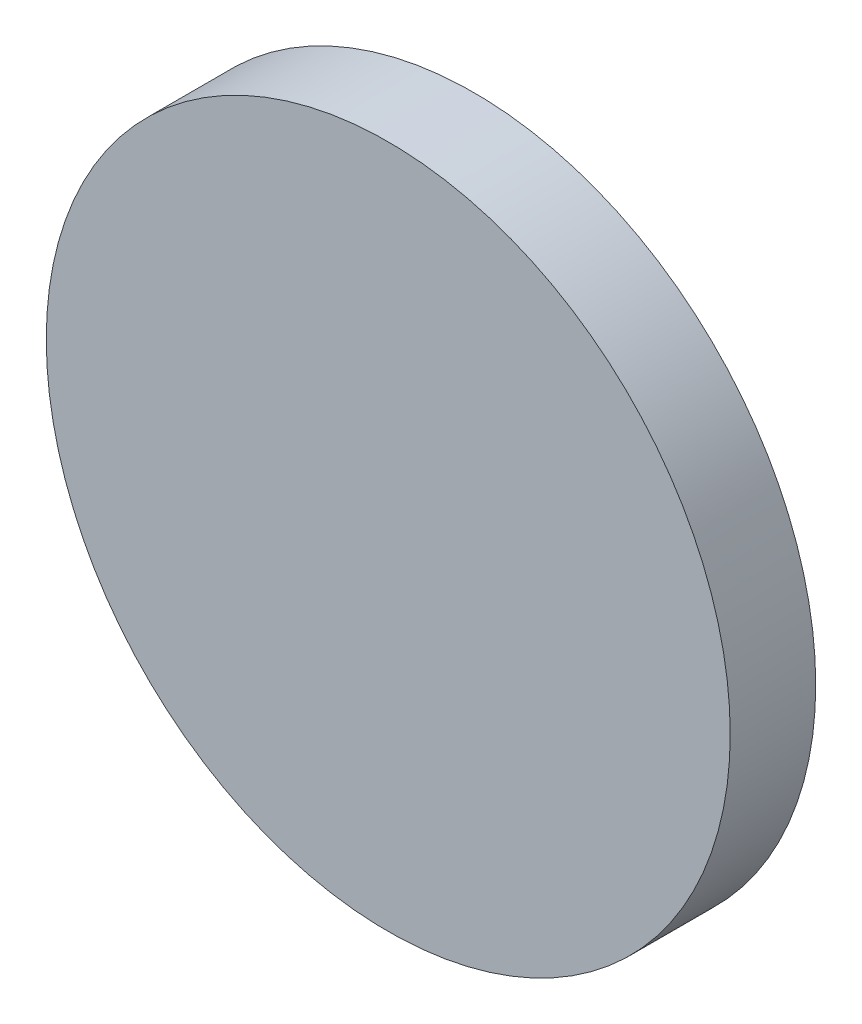
from build123d import *

# Parameters (mm, degrees)
SKETCH1_R           = 20
BOSS_EXTRUDE1_DEPTH = 5


with BuildPart() as part:
    # Sketch1 → Boss-Extrude1 (new body)
    with BuildSketch(Plane.XY):
        Circle(SKETCH1_R)
    extrude(amount=BOSS_EXTRUDE1_DEPTH)


solid = part.part
